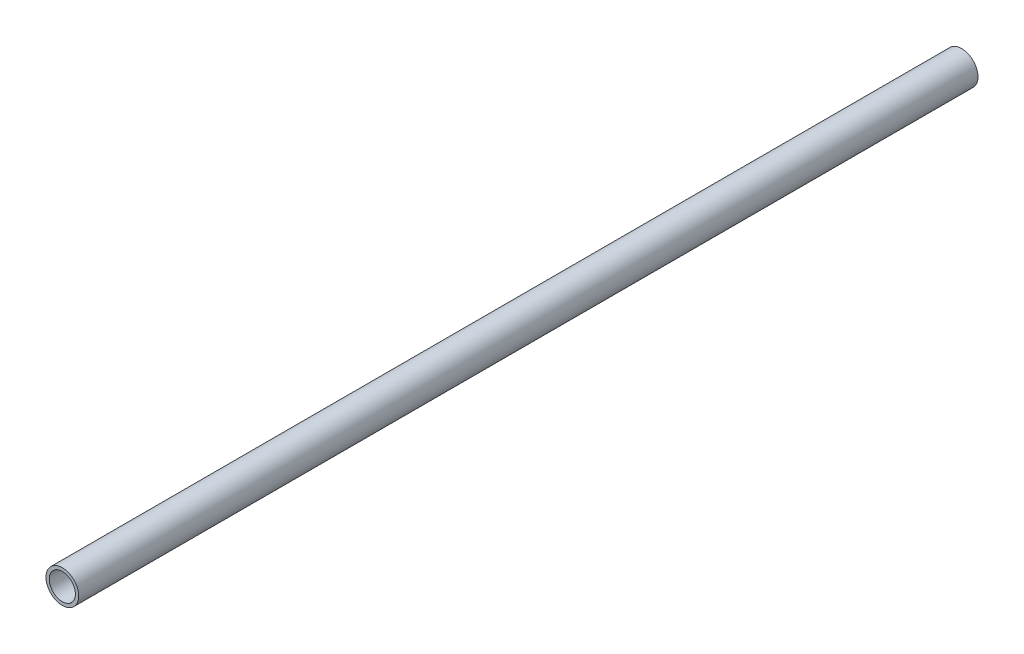
from build123d import *

# Parameters (mm, degrees)
SKETCH_1_R      = 5
SKETCH_1_R_2    = 4
EXTRUDE_1_DEPTH = 275


with BuildPart() as part:
    # ｽｹｯﾁ1 → ﾎﾞｽ - 押し出し1 (new body)
    with BuildSketch(Plane.XY):
        Circle(SKETCH_1_R)
        Circle(SKETCH_1_R_2, mode=Mode.SUBTRACT)
    extrude(amount=EXTRUDE_1_DEPTH)


solid = part.part
